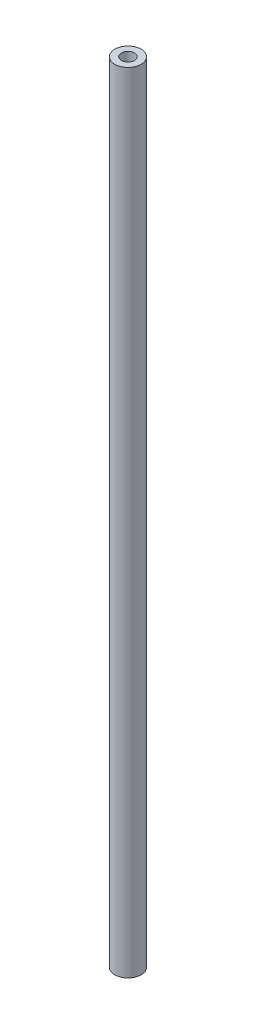
from build123d import *

# Parameters (mm, degrees)
SKETCH1_R           = 6.35
SKETCH1_R_2         = 3.175
BOSS_EXTRUDE1_DEPTH = 381


with BuildPart() as part:
    # Sketch1 → Boss-Extrude1 (new body)
    with BuildSketch(Plane(origin=(0, 0, 0), x_dir=(1, 0, 0), z_dir=(0, 1, 0))):
        with Locations(Location((0, 0, 0), (0, 0, 270))):
            Circle(SKETCH1_R)
        with Locations(Location((0, 0, 0), (0, 0, 270))):
            Circle(SKETCH1_R_2, mode=Mode.SUBTRACT)
    extrude(amount=BOSS_EXTRUDE1_DEPTH)


solid = part.part
